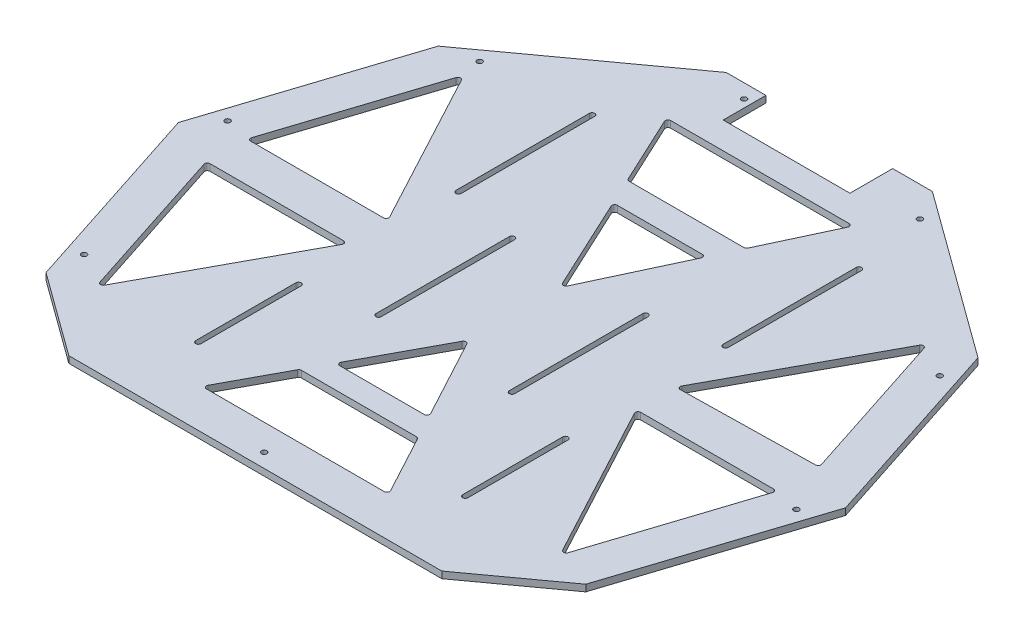
from build123d import *

# Parameters (mm, degrees)
SKETCH1_R           = 250
BOSS_EXTRUDE1_DEPTH = 5
SKETCH5_OUTSIDE_W   = 643.424
SKETCH5_OUTSIDE_H   = 643.424
CUT_EXTRUDE4_DEPTH  = 6
SKETCH6_R           = 2
CUT_EXTRUDE5_DEPTH  = 346.046056454
CUT_EXTRUDE6_DEPTH  = 346.046056454
SKETCH8_W           = 94.99
SKETCH8_H           = 32
CUT_EXTRUDE7_DEPTH  = 346.046056454
CUT_EXTRUDE8_DEPTH  = 346.046056454
FILLET1_R           = 2


with BuildPart() as part:
    # Sketch1 → Boss-Extrude1 (new body)
    with BuildSketch(Plane(origin=(0, 0, 0), x_dir=(1, 0, 0), z_dir=(0, 1, 0))):
        with Locations(Location((0, 0, 0), (0, 0, 270))):
            Circle(SKETCH1_R)
    extrude(amount=BOSS_EXTRUDE1_DEPTH)

    # Sketch5 outside → Cut-Extrude4 (cut)
    with BuildSketch(Plane(origin=(0, 5, 0), x_dir=(1, 0, 0), z_dir=(0, 1, 0))):
        Rectangle(SKETCH5_OUTSIDE_W, SKETCH5_OUTSIDE_H)
        Polygon((-139.754248594, -192.355221073), (139.754248594, -192.355221073), (202.254248594, -146.946313073), (250, 0), (202.254248594, 146.946313073), (77.254248594, 237.764129074), (-77.254248594, 237.764129074), (-202.254248594, 146.946313073), (-250, 0), (-202.254248594, -146.946313073), align=None, mode=Mode.SUBTRACT)
    extrude(amount=-CUT_EXTRUDE4_DEPTH, mode=Mode.SUBTRACT)

    # Sketch6 → Cut-Extrude5 (cut, through all)
    with BuildSketch(Plane.XZ):
        with Locations(Location((-3.899248594, 181.855221073, 0), (0, 0, 270))):
            Circle(SKETCH6_R)
        with Locations(Location((-199.656287114, 120.963302587, 0), (0, 0, 270))):
            Circle(SKETCH6_R)
        with Locations(Location((-232.625774638, -19.493653604, 0), (0, 0, 270))):
            Circle(SKETCH6_R)
        with Locations(Location((-176.74012291, -152.504696683, 0), (0, 0, 270))):
            Circle(SKETCH6_R)
        with Locations(Location((-53.345751406, -227.264129074, 0), (0, 0, 270))):
            Circle(SKETCH6_R)
        with Locations(Location((90.424883979, -215.216388582, 0), (0, 0, 270))):
            Circle(SKETCH6_R)
        with Locations(Location((199.656287114, -120.963302587, 0), (0, 0, 270))):
            Circle(SKETCH6_R)
        with Locations(Location((232.625774638, 19.493653604, 0), (0, 0, 270))):
            Circle(SKETCH6_R)
    extrude(amount=-CUT_EXTRUDE5_DEPTH, mode=Mode.SUBTRACT)

    # Sketch7 → Cut-Extrude6 (cut, through all)
    with BuildSketch(Plane(origin=(0, 5, 0), x_dir=(1, 0, 0), z_dir=(0, 1, 0))):
        with BuildLine():
            Line((98, 160), (98, 60))
            ThreePointArc((98, 60), (100, 58), (102, 60))
            Line((102, 60), (102, 160))
            ThreePointArc((102, 160), (100, 162), (98, 160))
        make_face()
        with BuildLine():
            Line((-48, -50), (-48, 50))
            ThreePointArc((-48, 50), (-50, 52), (-52, 50))
            Line((-52, 50), (-52, -50))
            ThreePointArc((-52, -50), (-50, -52), (-48, -50))
        make_face()
        with BuildLine():
            Line((52, -50), (52, 50))
            ThreePointArc((52, 50), (50, 52), (48, 50))
            Line((48, 50), (48, -50))
            ThreePointArc((48, -50), (50, -52), (52, -50))
        make_face()
        with BuildLine():
            Line((102, -135), (102, -60))
            ThreePointArc((102, -60), (100, -58), (98, -60))
            Line((98, -60), (98, -135))
            ThreePointArc((98, -135), (100, -137), (102, -135))
        make_face()
        with BuildLine():
            Line((-98, -135), (-98, -60))
            ThreePointArc((-98, -60), (-100, -58), (-102, -60))
            Line((-102, -60), (-102, -135))
            ThreePointArc((-102, -135), (-100, -137), (-98, -135))
        make_face()
        with BuildLine():
            Line((-98, 60), (-98, 160))
            ThreePointArc((-98, 160), (-100, 162), (-102, 160))
            Line((-102, 160), (-102, 60))
            ThreePointArc((-102, 60), (-100, 58), (-98, 60))
        make_face()
    extrude(amount=-CUT_EXTRUDE6_DEPTH, mode=Mode.SUBTRACT)

    # Sketch8 → Cut-Extrude7 (cut, through all)
    with BuildSketch(Plane.XZ):
        with Locations((0.000751406, -221.764129074)):
            Rectangle(SKETCH8_W, SKETCH8_H)
    extrude(amount=-CUT_EXTRUDE7_DEPTH, mode=Mode.SUBTRACT)

    # Sketch9 → Cut-Extrude8 (cut, through all)
    with BuildSketch(Plane(origin=(0, 5, 0), x_dir=(1, 0, 0), z_dir=(0, 1, 0))):
        Polygon((-108.026447281, -14.820317486), (-214.211563551, -14.820317486), (-174.39449797, -137.364644721), align=None)
        Polygon((-173.702637163, 137.737098208), (-213.582337829, 15), (-108.026447281, 15), align=None)
        Polygon((-70, 185.764129074), (-44.333333333, 130.764129074), (44.333333333, 130.764129074), (70, 185.764129074), align=None)
        Polygon((-35, 110.764129074), (0, 35.764129074), (35, 110.764129074), align=None)
        Polygon((0, -32.355221073), (-35, -97.355221073), (35, -97.355221073), align=None)
        Polygon((-44.333333333, -114.688554407), (-70, -162.355221073), (70, -162.355221073), (44.333333333, -114.688554407), align=None)
        Polygon((213.640720217, -14.820317486), (107.9302998, -14.820317486), (173.702637163, -137.737098208), align=None)
        Polygon((174.39449797, 137.364644721), (107.9302998, 14.64278736), (213.640720217, 16.577192616), align=None)
    extrude(amount=-CUT_EXTRUDE8_DEPTH, mode=Mode.SUBTRACT)

    # Fillet1
    fillet1_edges = [part.edges().sort_by_distance(p)[0] for p in [
        (-108.026447281, 2.5, 14.820317486),
        (-174.39449797, 2.5, 137.364644721),
        (-214.211563551, 2.5, 14.820317486),
        (-108.026447281, 2.5, -15),
        (-213.582337829, 2.5, -15),
        (-173.702637163, 2.5, -137.737098208),
        (-44.333333333, 2.5, -130.764129074),
        (-70, 2.5, -185.764129074),
        (70, 2.5, -185.764129074),
        (44.333333333, 2.5, -130.764129074),
        (-35, 2.5, -110.764129074),
        (35, 2.5, -110.764129074),
        (0, 2.5, -35.764129074),
        (-35, 2.5, 97.355221073),
        (0, 2.5, 32.355221073),
        (35, 2.5, 97.355221073),
        (-44.333333333, 2.5, 114.688554407),
        (44.333333333, 2.5, 114.688554407),
        (70, 2.5, 162.355221073),
        (-70, 2.5, 162.355221073),
        (107.9302998, 2.5, 14.820317486),
        (213.640720217, 2.5, 14.820317486),
        (173.702637163, 2.5, 137.737098208),
        (213.640720217, 2.5, -16.577192616),
        (107.9302998, 2.5, -14.64278736),
        (174.39449797, 2.5, -137.364644721),
    ]]
    fillet(fillet1_edges, radius=FILLET1_R)


solid = part.part
